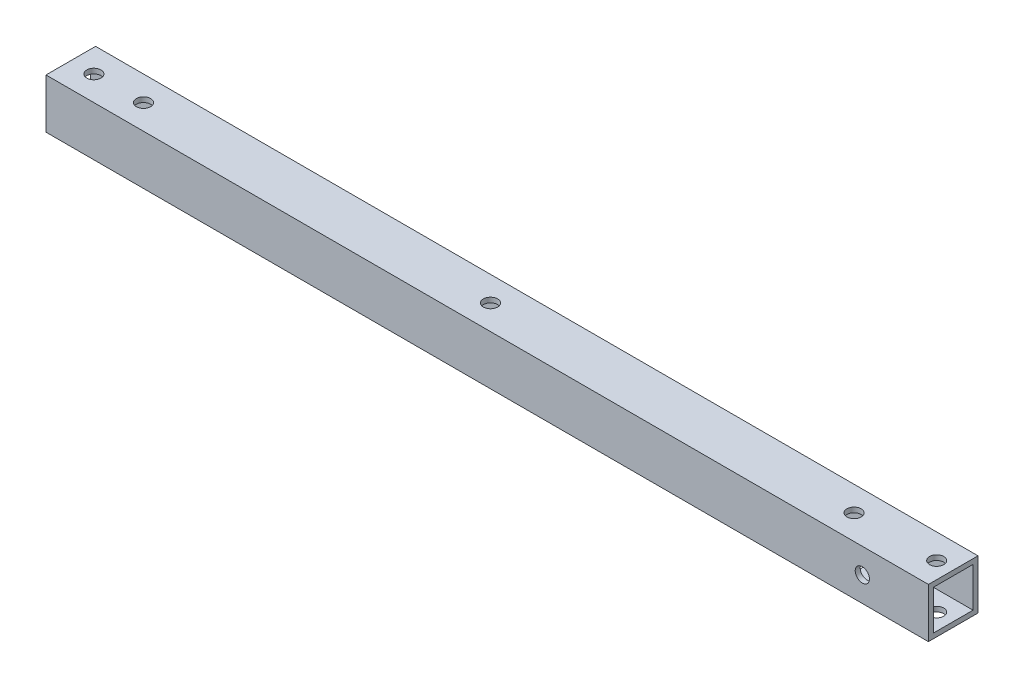
from build123d import *

# Parameters (mm, degrees)
SKETCH_1_W          = 15
SKETCH_1_H          = 15
SKETCH_1_W_2        = 12
SKETCH_1_H_2        = 12
EXTRUDE_1_DEPTH     = 267
SKETCH_2_R          = 2.15
CUT_EXTRUDE_1_DEPTH = 268.526166944
SKETCH_3_R          = 2.15
CUT_EXTRUDE_2_DEPTH = 268.526166944


with BuildPart() as part:
    # ｽｹｯﾁ1 → 押し出し-薄板1 (new body)
    with BuildSketch(Plane(origin=(0, 0, 0), x_dir=(0, 0, -1), z_dir=(1, 0, 0))):
        Rectangle(SKETCH_1_W, SKETCH_1_H)
        Rectangle(SKETCH_1_W_2, SKETCH_1_H_2, mode=Mode.SUBTRACT)
    extrude(amount=EXTRUDE_1_DEPTH)

    # ｽｹｯﾁ2 → ｶｯﾄ - 押し出し1 (cut, through all)
    with BuildSketch(Plane(origin=(0, 7.5, 0), x_dir=(1, 0, 0), z_dir=(0, 1, 0))):
        with Locations(Location((262, 0, 0), (0, 0, 270))):
            Circle(SKETCH_2_R)
        with Locations(Location((22, 0, 0), (0, 0, 270))):
            Circle(SKETCH_2_R)
        with Locations(Location((7, 0, 0), (0, 0, 270))):
            Circle(SKETCH_2_R)
        with Locations(Location((237, 0, 0), (0, 0, 270))):
            Circle(SKETCH_2_R)
        with Locations(Location((127, 0, 0), (0, 0, 270))):
            Circle(SKETCH_2_R)
    extrude(amount=-CUT_EXTRUDE_1_DEPTH, mode=Mode.SUBTRACT)

    # ｽｹｯﾁ3 → ｶｯﾄ - 押し出し2 (cut, through all)
    with BuildSketch(Plane.XY.offset(7.5)):
        with Locations((247, 0)):
            Circle(SKETCH_3_R)
    extrude(amount=-CUT_EXTRUDE_2_DEPTH, mode=Mode.SUBTRACT)


solid = part.part
